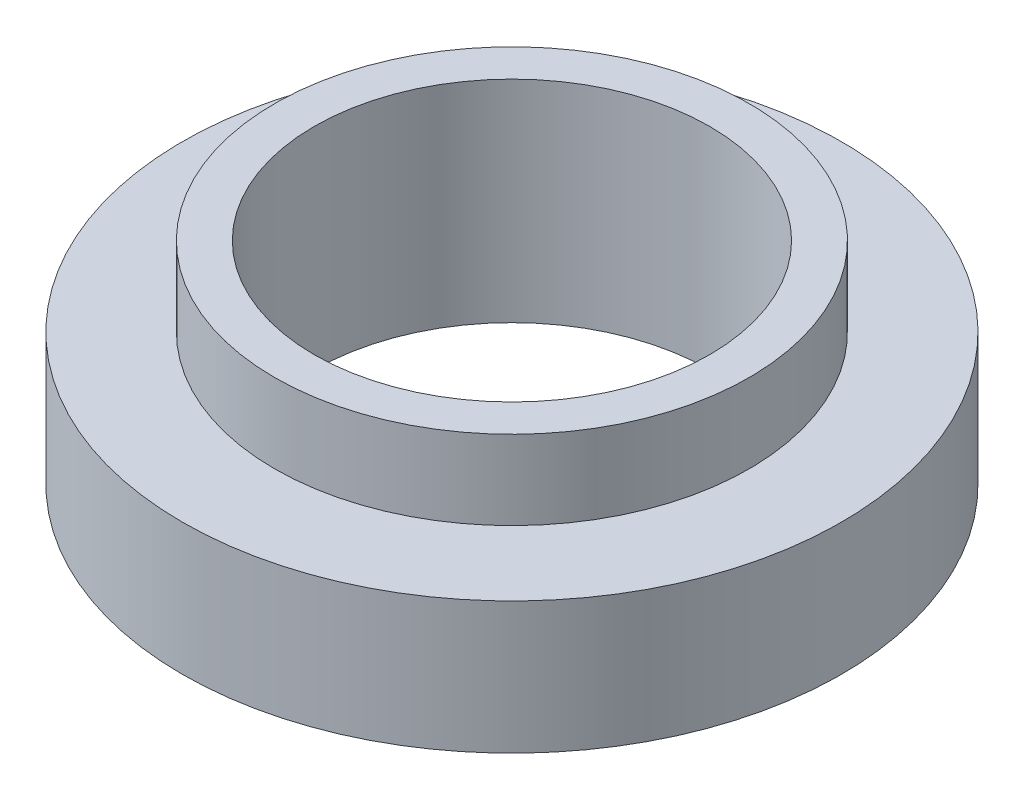
from build123d import *

# Parameters (mm, degrees)
SKETCH1_R           = 12.5
BOSS_EXTRUDE1_DEPTH = 5
SKETCH2_R           = 9
BOSS_EXTRUDE2_DEPTH = 3
SKETCH3_R           = 7.5
CUT_EXTRUDE1_DEPTH  = 13


with BuildPart() as part:
    # Sketch1 → Boss-Extrude1 (new body)
    with BuildSketch(Plane(origin=(0, 0, 0), x_dir=(1, 0, 0), z_dir=(0, 1, 0))):
        with Locations(Location((0, 0, 0), (0, 0, 270))):
            Circle(SKETCH1_R)
    extrude(amount=BOSS_EXTRUDE1_DEPTH)

    # Sketch2 → Boss-Extrude2 (add)
    with BuildSketch(Plane(origin=(0, 5, 0), x_dir=(1, 0, 0), z_dir=(0, 1, 0))):
        with Locations(Location((0, 0, 0), (0, 0, 270))):
            Circle(SKETCH2_R)
    extrude(amount=BOSS_EXTRUDE2_DEPTH)

    # Sketch3 → Cut-Extrude1 (cut)
    with BuildSketch(Plane(origin=(0, 8, 0), x_dir=(1, 0, 0), z_dir=(0, 1, 0))):
        with Locations(Location((0, 0, 0), (0, 0, 270))):
            Circle(SKETCH3_R)
    extrude(amount=-CUT_EXTRUDE1_DEPTH, mode=Mode.SUBTRACT)


solid = part.part
